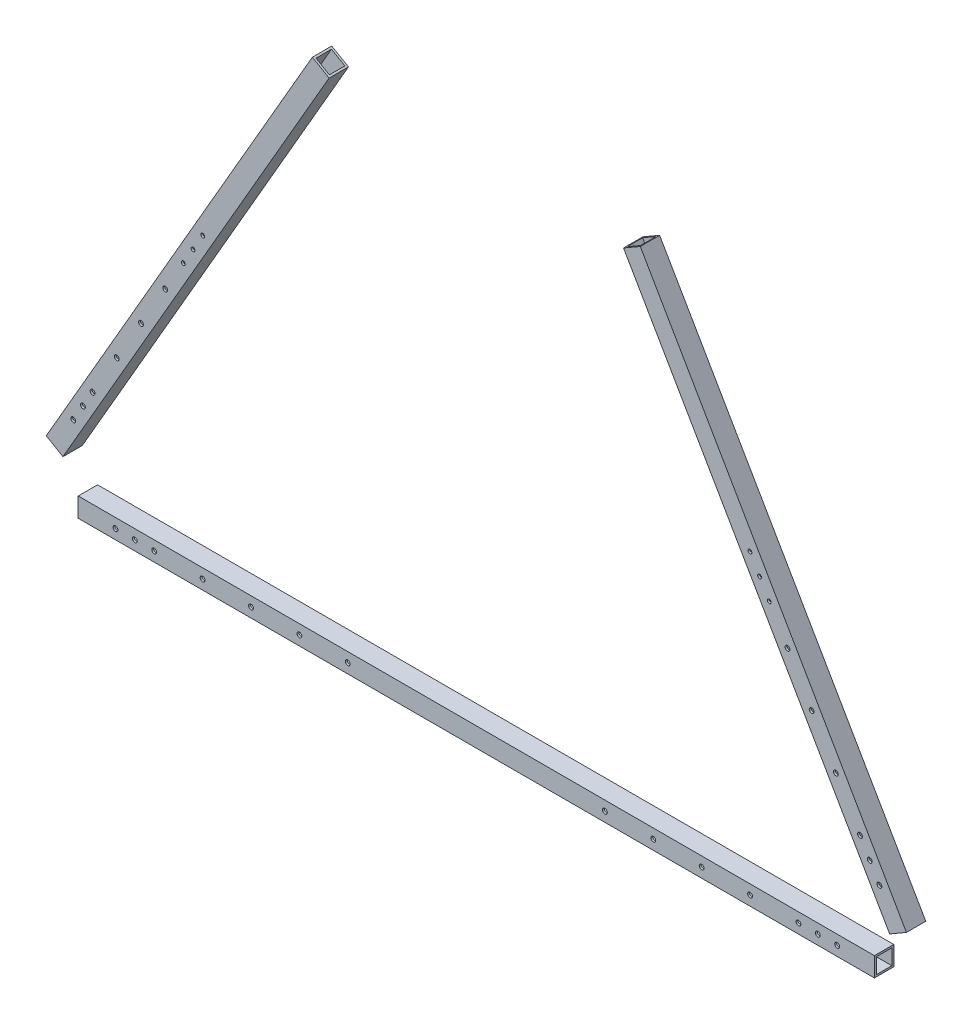
from build123d import *

# Parameters (mm, degrees)
SKETCH_3_W          = 20
SKETCH_3_H          = 20
SKETCH_3_W_2        = 16
SKETCH_3_H_2        = 16
SKETCH_4_R          = 2
CUT_EXTRUDE_1_DEPTH = 709.01041227
SKETCH_5_R          = 2.5
CUT_EXTRUDE_2_DEPTH = 687.141250789


with BuildPart() as part:
    # 扫描1: sweep along a path in 草图2
    with BuildLine(Plane.XY) as sweep_1_path:
        Line((150, 0), (438.675134595, -500))
        Line((438.675134595, -500), (-438.675134595, -500))
        Line((-438.675134595, -500), (-150, 0))
    # 草图3 → 扫描1 (sweep)
    with BuildSketch(Plane(origin=(37.5, -64.951905284, 0), x_dir=(-0.8660254037844362, -0.5000000000000044, 0), z_dir=(-0.5000000000000044, 0.8660254037844362, 0))):
        with Locations((-142.302494708, 0)):
            Rectangle(SKETCH_3_W, SKETCH_3_H)
        with Locations((-142.302494708, 0)):
            Rectangle(SKETCH_3_W_2, SKETCH_3_H_2, mode=Mode.SUBTRACT)
    sweep(path=sweep_1_path.line, transition=Transition.RIGHT)

    # 草图4 → 切除-拉伸1 (cut, through all)
    with BuildSketch(Plane.XY.offset(10)):
        with Locations((-302.718707407, -239.719192216)):
            Circle(SKETCH_4_R)
        with Locations((-292.718707407, -222.39868414)):
            Circle(SKETCH_4_R)
        with Locations((-282.718707407, -205.078176064)):
            Circle(SKETCH_4_R)
        with Locations(Location((282.718707407, -205.078176064, 0), (0, 0, 180))):
            Circle(SKETCH_4_R)
        with Locations(Location((292.718707407, -222.39868414, 0), (0, 0, 180))):
            Circle(SKETCH_4_R)
        with Locations(Location((302.718707407, -239.719192216, 0), (0, 0, 180))):
            Circle(SKETCH_4_R)
        Polygon((-444.397829477, -465.114630011), (-427.077321401, -475.114630011), (-442.829777396, -502.39868414), (-411.324865405, -502.39868414), (-411.324865405, -522.39868414), (-477.470793548, -522.39868414), align=None)
        Polygon((411.324865405, -502.39868414), (442.829777396, -502.39868414), (427.077321401, -475.114630011), (444.397829477, -465.114630011), (477.470793548, -522.39868414), (411.324865405, -522.39868414), align=None)
    extrude(amount=-CUT_EXTRUDE_1_DEPTH, mode=Mode.SUBTRACT)


with BuildPart() as cut_extrude_1_piece_1:
    # of the separate pieces the step leaves, piece 1, a body of its own (cut_extrude_1_pieces)
    add(part.part.solids().sort_by_distance((411.324865405, -502.39868414, 10))[0])


with BuildPart() as cut_extrude_1_piece_2:
    # of the separate pieces the step leaves, piece 2, a body of its own (cut_extrude_1_pieces)
    add(part.part.solids().sort_by_distance((-427.077321401, -475.114630011, 10))[0])


with BuildPart() as cut_extrude_1_piece_3:
    # of the separate pieces the step leaves, piece 3, a body of its own (cut_extrude_1_pieces)
    add(part.part.solids().sort_by_distance((152.077321401, 1.19934207, 10))[0])


with BuildPart() as cut_extrude_2_tool:
    # 草图5 → 切除-拉伸2 (new, through all)
    with BuildSketch(Plane.XY.offset(10)):
        with Locations((-372.824865405, -512.39868414)):
            Circle(SKETCH_5_R)
        with Locations((-352.824865405, -512.39868414)):
            Circle(SKETCH_5_R)
        with Locations((-332.824865405, -512.39868414)):
            Circle(SKETCH_5_R)
        with Locations((-282.824865405, -512.39868414)):
            Circle(SKETCH_5_R)
        with Locations((-232.824865405, -512.39868414)):
            Circle(SKETCH_5_R)
        with Locations((-182.824865405, -512.39868414)):
            Circle(SKETCH_5_R)
        with Locations((-132.824865405, -512.39868414)):
            Circle(SKETCH_5_R)
        with Locations(Location((-321.487575439, -272.227825247, 0), (0, 0, 180))):
            Circle(SKETCH_5_R)
        with Locations(Location((-346.487575439, -315.529095436, 0), (0, 0, 180))):
            Circle(SKETCH_5_R)
        with Locations(Location((-371.487575439, -358.830365625, 0), (0, 0, 180))):
            Circle(SKETCH_5_R)
        with Locations(Location((-396.487575439, -402.131635814, 0), (0, 0, 180))):
            Circle(SKETCH_5_R)
        with Locations(Location((-406.487575439, -419.45214389, 0), (0, 0, 180))):
            Circle(SKETCH_5_R)
        with Locations(Location((-416.487575439, -436.772651966, 0), (0, 0, 180))):
            Circle(SKETCH_5_R)
        with Locations(Location((232.824865405, -512.39868414, 0), (0, 0, 90))):
            Circle(SKETCH_5_R)
        with Locations(Location((282.824865405, -512.39868414, 0), (0, 0, 90))):
            Circle(SKETCH_5_R)
        with Locations(Location((332.824865405, -512.39868414, 0), (0, 0, 90))):
            Circle(SKETCH_5_R)
        with Locations(Location((352.824865405, -512.39868414, 0), (0, 0, 90))):
            Circle(SKETCH_5_R)
        with Locations(Location((372.824865405, -512.39868414, 0), (0, 0, 90))):
            Circle(SKETCH_5_R)
        with Locations(Location((132.824865405, -512.39868414, 0), (0, 0, 90))):
            Circle(SKETCH_5_R)
        with Locations(Location((182.824865405, -512.39868414, 0), (0, 0, 90))):
            Circle(SKETCH_5_R)
        with Locations((396.487575439, -402.131635814)):
            Circle(SKETCH_5_R)
        with Locations((371.487575439, -358.830365625)):
            Circle(SKETCH_5_R)
        with Locations((346.487575439, -315.529095436)):
            Circle(SKETCH_5_R)
        with Locations((321.487575439, -272.227825247)):
            Circle(SKETCH_5_R)
        with Locations((416.487575439, -436.772651966)):
            Circle(SKETCH_5_R)
        with Locations((406.487575439, -419.45214389)):
            Circle(SKETCH_5_R)
    extrude(amount=-CUT_EXTRUDE_2_DEPTH)


with BuildPart() as cut_extrude_1_piece_1_1:
    add(cut_extrude_1_piece_1.part)

    # 切除-拉伸2: cut by cut_extrude_2_tool
    add(cut_extrude_2_tool.part, mode=Mode.SUBTRACT)


with BuildPart() as cut_extrude_1_piece_2_1:
    add(cut_extrude_1_piece_2.part)

    # 切除-拉伸2: cut by cut_extrude_2_tool
    add(cut_extrude_2_tool.part, mode=Mode.SUBTRACT)


with BuildPart() as cut_extrude_1_piece_3_1:
    add(cut_extrude_1_piece_3.part)

    # 切除-拉伸2: cut by cut_extrude_2_tool
    add(cut_extrude_2_tool.part, mode=Mode.SUBTRACT)


solid = Compound([cut_extrude_1_piece_1_1.part, cut_extrude_1_piece_2_1.part, cut_extrude_1_piece_3_1.part])
